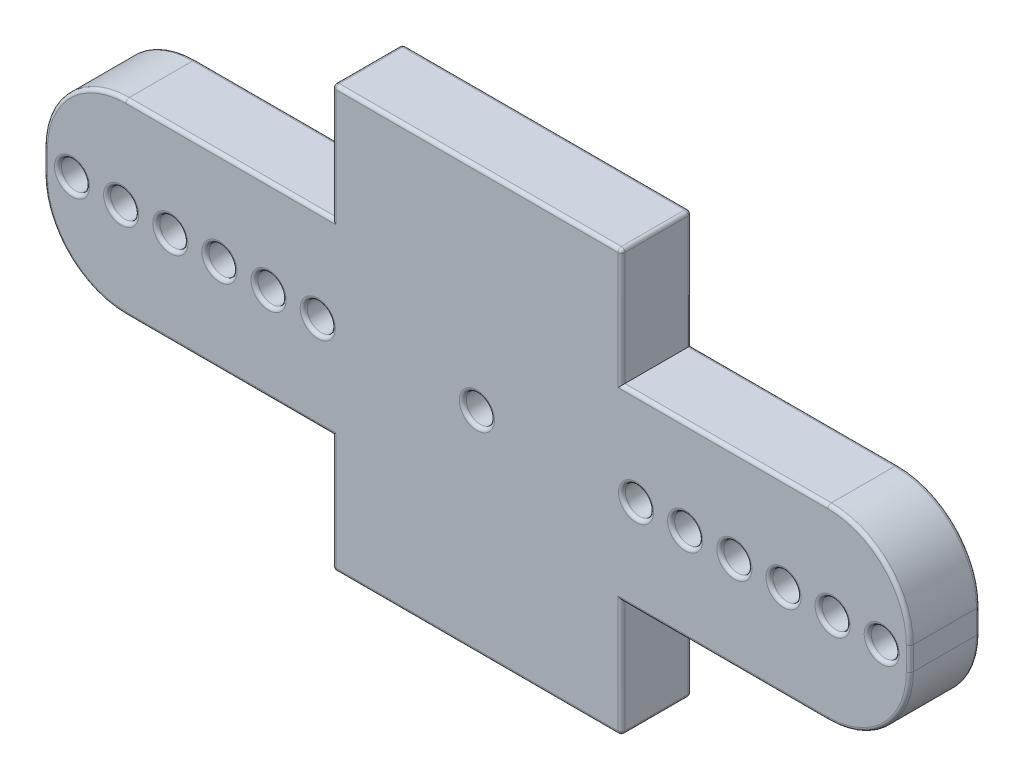
from build123d import *

# Parameters (mm, degrees)
SKETCH1_R           = 0.6
SKETCH1_R_2         = 0.600711192
BOSS_EXTRUDE1_DEPTH = 1.5
FILLET1_R           = 0.15


with BuildPart() as part:
    # Sketch1 → Boss-Extrude1 (new, symmetric)
    with BuildSketch(Plane.XY):
        with BuildLine():
            Line((-6.175, 9), (6.175, 9))
            Line((6.175, 9), (6.175, 4))
            Line((6.175, 4), (15, 4))
            ThreePointArc((15, 4), (17.474873734, 2.974873734), (18.5, 0.5))
            Line((18.5, 0.5), (18.5, -0.5))
            ThreePointArc((18.5, -0.5), (17.474873734, -2.974873734), (15, -4))
            Line((15, -4), (6.175, -4))
            Line((6.175, -4), (6.175, -9))
            Line((6.175, -9), (-6.175, -9))
            Line((-6.175, -9), (-6.175, -4))
            Line((-6.175, -4), (-15, -4))
            ThreePointArc((-15, -4), (-17.474873734, -2.974873734), (-18.5, -0.5))
            Line((-18.5, -0.5), (-18.5, 0.5))
            ThreePointArc((-18.5, 0.5), (-17.474873734, 2.974873734), (-15, 4))
            Line((-15, 4), (-6.175, 4))
            Line((-6.175, 4), (-6.175, 9))
        make_face()
        Circle(SKETCH1_R, mode=Mode.SUBTRACT)
        with Locations((-17.3, 0)):
            Circle(SKETCH1_R_2, mode=Mode.SUBTRACT)
        with Locations((-15.2, 0)):
            Circle(SKETCH1_R_2, mode=Mode.SUBTRACT)
        with Locations((-13.1, 0)):
            Circle(SKETCH1_R_2, mode=Mode.SUBTRACT)
        with Locations((-11, 0)):
            Circle(SKETCH1_R_2, mode=Mode.SUBTRACT)
        with Locations((-8.9, 0)):
            Circle(SKETCH1_R_2, mode=Mode.SUBTRACT)
        with Locations((-6.8, 0)):
            Circle(SKETCH1_R_2, mode=Mode.SUBTRACT)
        with Locations(Location((6.8, 0, 0), (0, 0, 180))):
            Circle(SKETCH1_R_2, mode=Mode.SUBTRACT)
        with Locations(Location((8.9, 0, 0), (0, 0, 180))):
            Circle(SKETCH1_R_2, mode=Mode.SUBTRACT)
        with Locations(Location((11, 0, 0), (0, 0, 180))):
            Circle(SKETCH1_R_2, mode=Mode.SUBTRACT)
        with Locations(Location((13.1, 0, 0), (0, 0, 180))):
            Circle(SKETCH1_R_2, mode=Mode.SUBTRACT)
        with Locations(Location((15.2, 0, 0), (0, 0, 180))):
            Circle(SKETCH1_R_2, mode=Mode.SUBTRACT)
        with Locations(Location((17.3, 0, 0), (0, 0, 180))):
            Circle(SKETCH1_R_2, mode=Mode.SUBTRACT)
    extrude(amount=BOSS_EXTRUDE1_DEPTH, both=True)

    # Fillet1
    fillet1_edges = [part.edges().sort_by_distance(p)[0] for p in [
        (-6.175, 6.5, 1.5),
        (10.5875, 4, -1.5),
        (17.474873734, 2.974873734, -1.5),
        (18.5, 0, -1.5),
        (-10.5875, 4, 1.5),
        (17.474873734, -2.974873734, -1.5),
        (10.5875, -4, -1.5),
        (6.175, -6.5, -1.5),
        (0, -9, -1.5),
        (-6.175, -6.5, -1.5),
        (-10.5875, -4, -1.5),
        (-17.474873734, -2.974873734, -1.5),
        (-18.5, 0, -1.5),
        (-17.474873734, 2.974873734, -1.5),
        (-10.5875, 4, -1.5),
        (-17.474873734, 2.974873734, 1.5),
        (-6.175, 6.5, -1.5),
        (0, 9, -1.5),
        (6.175, 6.5, -1.5),
        (-18.5, 0, 1.5),
        (6.175, -9, 0),
        (-6.175, -9, 0),
        (-6.175, 9, 0),
        (6.175, 9, 0),
        (-17.474873734, -2.974873734, 1.5),
        (-10.5875, -4, 1.5),
        (-6.175, -6.5, 1.5),
        (-17.900711192, 0, -1.5),
        (-17.900711192, 0, 1.5),
        (0, -9, 1.5),
        (-0.6, 0, -1.5),
        (-0.6, 0, 1.5),
        (6.175, -6.5, 1.5),
        (7.400711192, 0, -1.5),
        (7.400711192, 0, 1.5),
        (10.5875, -4, 1.5),
        (6.175, 6.5, 1.5),
        (-15.800711192, 0, -1.5),
        (-15.800711192, 0, 1.5),
        (17.474873734, -2.974873734, 1.5),
        (-13.700711192, 0, -1.5),
        (-13.700711192, 0, 1.5),
        (18.5, 0, 1.5),
        (-11.600711192, 0, -1.5),
        (-11.600711192, 0, 1.5),
        (17.474873734, 2.974873734, 1.5),
        (-9.500711192, 0, -1.5),
        (-9.500711192, 0, 1.5),
        (10.5875, 4, 1.5),
        (-7.400711192, 0, -1.5),
        (-7.400711192, 0, 1.5),
        (9.500711192, 0, -1.5),
        (9.500711192, 0, 1.5),
        (11.600711192, 0, -1.5),
        (11.600711192, 0, 1.5),
        (13.700711192, 0, -1.5),
        (13.700711192, 0, 1.5),
        (15.800711192, 0, -1.5),
        (15.800711192, 0, 1.5),
        (17.900711192, 0, -1.5),
        (17.900711192, 0, 1.5),
        (0, 9, 1.5),
    ]]
    fillet(fillet1_edges, radius=FILLET1_R)


solid = part.part
